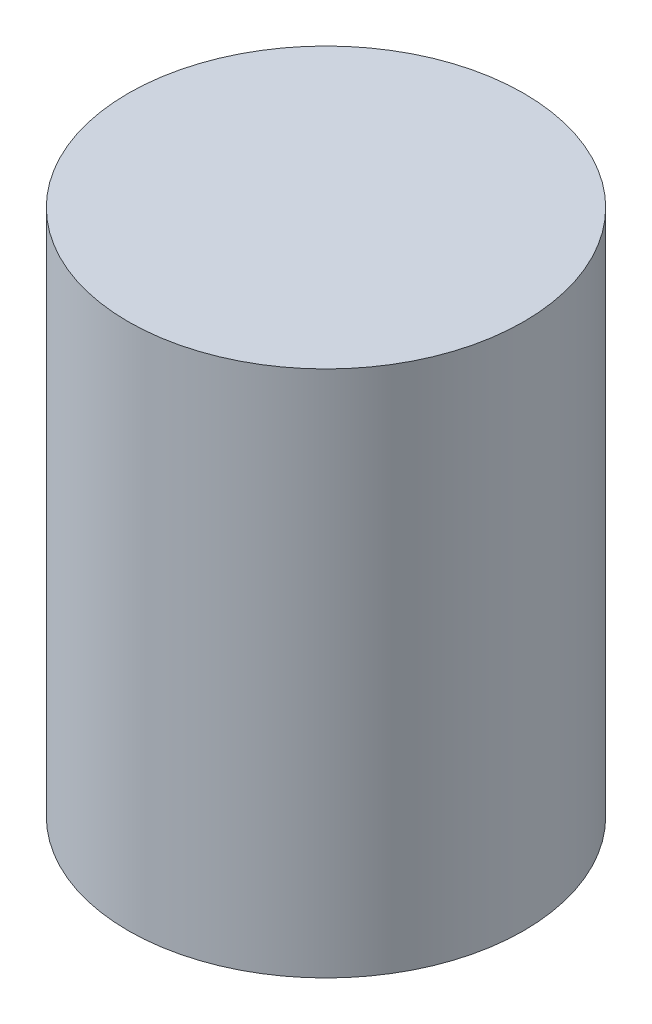
from build123d import *

# Parameters (mm, degrees)
SKETCH1_R      = 57.15
EXTRUDE1_DEPTH = 152.4


with BuildPart() as part:
    # Sketch1 → Extrude1 (new body)
    with BuildSketch(Plane(origin=(0, 152.4, 0), x_dir=(1, 0, 0), z_dir=(0, 1, 0))):
        with Locations(Location((0, 0, 0), (0, 0, 90))):
            Circle(SKETCH1_R)
    extrude(amount=EXTRUDE1_DEPTH)


solid = part.part
